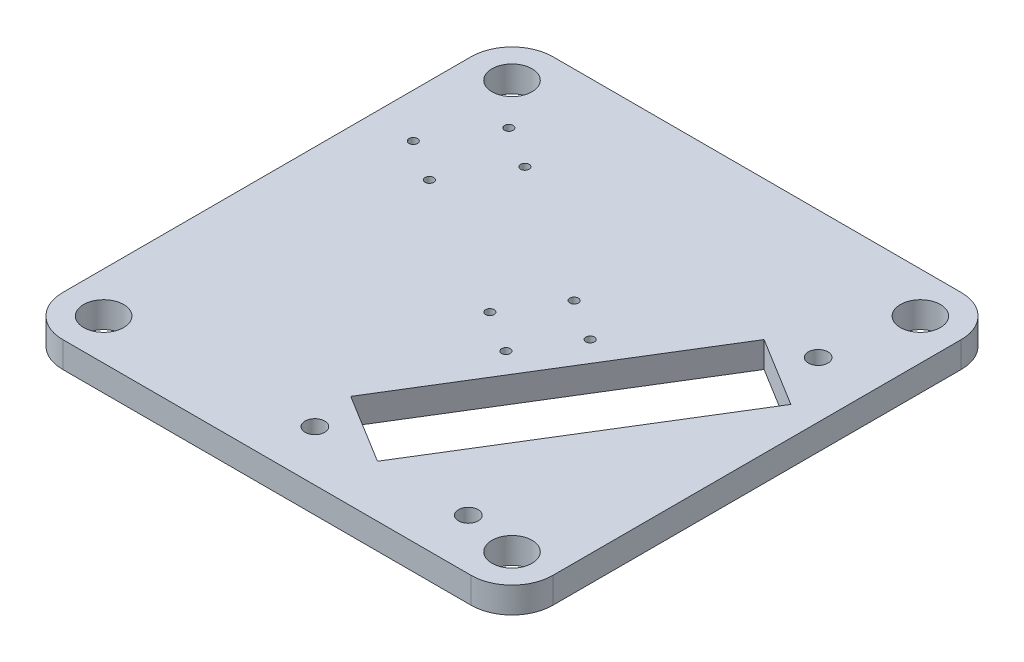
from build123d import *

# Parameters (mm, degrees)
BOSS_EXTRUDE1_DEPTH = 6.35
SKETCH2_R           = 2.4
SKETCH2_R_2         = 4.9
CUT_EXTRUDE1_DEPTH  = 170.824387236
SKETCH5_R           = 1.05
CUT_EXTRUDE2_DEPTH  = 170.824387236


with BuildPart() as part:
    # Sketch1 → Boss-Extrude1 (new body)
    with BuildSketch(Plane(origin=(0, 0, 0), x_dir=(1, 0, 0), z_dir=(0, 1, 0))):
        with BuildLine():
            Line((10, 0), (110, 0))
            ThreePointArc((110, 0), (117.071067812, 2.928932188), (120, 10))
            Line((120, 10), (120, 110))
            ThreePointArc((120, 110), (117.071067812, 117.071067812), (110, 120))
            Line((110, 120), (10, 120))
            ThreePointArc((10, 120), (2.928932188, 117.071067812), (0, 110))
            Line((0, 110), (0, 10))
            ThreePointArc((0, 10), (2.928932188, 2.928932188), (10, 0))
        make_face()
    extrude(amount=BOSS_EXTRUDE1_DEPTH)

    # Sketch2 → Cut-Extrude1 (cut, through all)
    with BuildSketch(Plane(origin=(0, 6.35, 0), x_dir=(1, 0, 0), z_dir=(0, 1, 0))):
        with Locations(Location((59.326447526, 12.4, 0), (0, 0, 270))):
            Circle(SKETCH2_R)
        with Locations(Location((96.90831454, 12.4, 0), (0, 0, 270))):
            Circle(SKETCH2_R)
        with Locations(Location((106.276743553, 88.69973137, 0), (0, 0, 270))):
            Circle(SKETCH2_R)
        with Locations(Location((10, 110, 0), (0, 0, 270))):
            Circle(SKETCH2_R_2)
        with Locations(Location((10, 10, 0), (0, 0, 270))):
            Circle(SKETCH2_R_2)
        with Locations(Location((110, 110, 0), (0, 0, 270))):
            Circle(SKETCH2_R_2)
        with Locations(Location((110, 10, 0), (0, 0, 270))):
            Circle(SKETCH2_R_2)
        Polygon((57.291464341, 23.213164461), (74.324967949, 12.731764037), (112.886040109, 75.398023809), (95.852536501, 85.879424234), align=None)
    extrude(amount=-CUT_EXTRUDE1_DEPTH, mode=Mode.SUBTRACT)

    # Sketch5 → Cut-Extrude2 (cut, through all)
    with BuildSketch(Plane(origin=(0, 6.35, 0), x_dir=(1, 0, 0), z_dir=(0, 1, 0))):
        with Locations(Location((66.679748999, 51.827220643, 0), (0, 0, 270))):
            Circle(SKETCH5_R)
        with Locations(Location((56.459646835, 58.116060898, 0), (0, 0, 270))):
            Circle(SKETCH5_R)
        with Locations(Location((74.540799318, 64.602348349, 0), (0, 0, 270))):
            Circle(SKETCH5_R)
        with Locations(Location((64.320697153, 70.891188603, 0), (0, 0, 270))):
            Circle(SKETCH5_R)
        with Locations(Location((10.796792254, 85.040096841, 0), (0, 0, 270))):
            Circle(SKETCH5_R)
        with Locations(Location((21.016894418, 78.751256587, 0), (0, 0, 270))):
            Circle(SKETCH5_R)
        with Locations(Location((29.926084779, 93.229734653, 0), (0, 0, 270))):
            Circle(SKETCH5_R)
        with Locations(Location((19.705982614, 99.518574908, 0), (0, 0, 270))):
            Circle(SKETCH5_R)
    extrude(amount=-CUT_EXTRUDE2_DEPTH, mode=Mode.SUBTRACT)


solid = part.part
